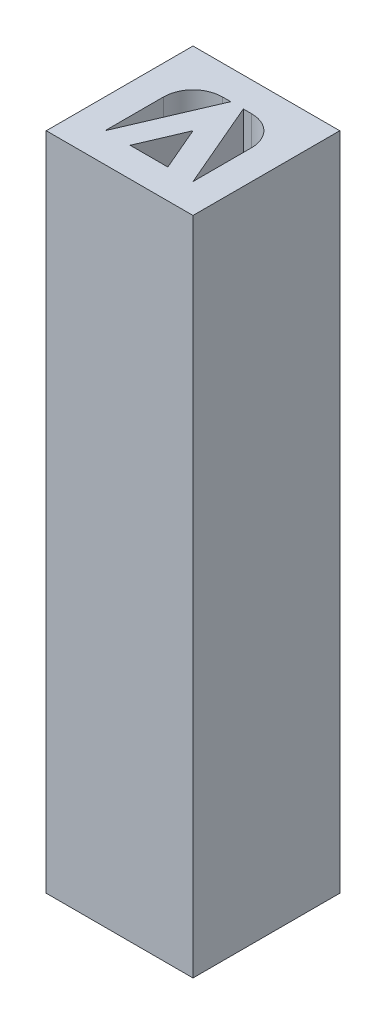
from build123d import *

# Parameters (mm, degrees)
SKETCH1_W           = 10
SKETCH1_H           = 10
SKETCH1_W_2         = 6
SKETCH1_H_2         = 6
BOSS_EXTRUDE1_DEPTH = 45
BOSS_EXTRUDE4_DEPTH = 45
FILLET2_R           = 2


with BuildPart() as part:
    # Sketch1 → Boss-Extrude1 (new body)
    with BuildSketch(Plane(origin=(0, 0, 0), x_dir=(1, 0, 0), z_dir=(0, 1, 0))):
        with Locations((5, 5)):
            Rectangle(SKETCH1_W, SKETCH1_H)
        with Locations((5, 5)):
            Rectangle(SKETCH1_W_2, SKETCH1_H_2, mode=Mode.SUBTRACT)
    extrude(amount=BOSS_EXTRUDE1_DEPTH)

    # Sketch3 → Boss-Extrude4 (add, through all)
    with BuildSketch(Plane.XZ):
        Polygon((8, -2), (5, -9), (2, -2), (3.714285714, -2), (5, -5), (6.285714286, -2), align=None)
    extrude(amount=-BOSS_EXTRUDE4_DEPTH)

    # Fillet2
    fillet2_edges = [part.edges().sort_by_distance(p)[0] for p in [
        (2, 22.5, -8),
        (8, 22.5, -8),
    ]]
    fillet(fillet2_edges, radius=FILLET2_R)


solid = part.part
